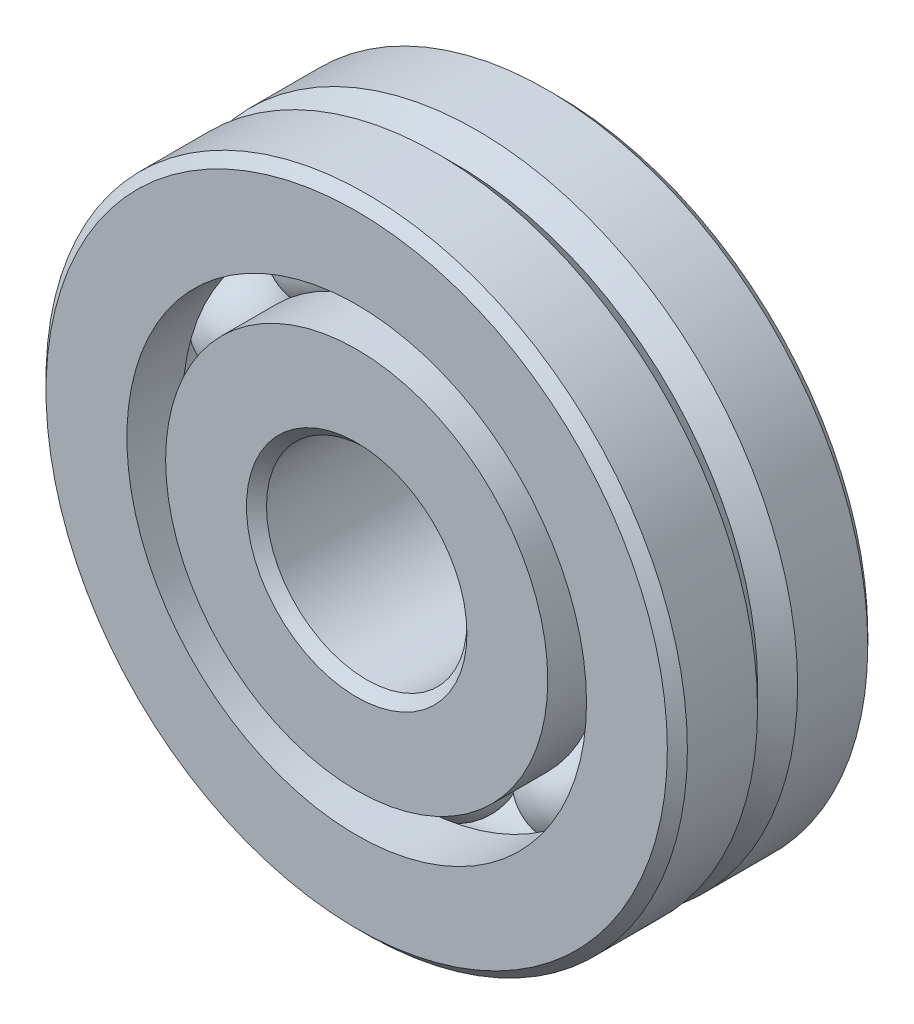
from build123d import *

# Parameters (mm, degrees)
CIRPATTERN1_COUNT = 10


with BuildPart() as part:
    # Sketch1 → Revolve1 (revolve)
    with BuildSketch(Plane(origin=(0, 0, 0), x_dir=(0, 0, -1), z_dir=(1, 0, 0))):
        with BuildLine():
            Line((2.25, 8), (0.5, 8))
            Line((0.5, 8), (0, 7.5))
            Line((0, 7.5), (-0.5, 8))
            Line((-0.5, 8), (-2.25, 8))
            Line((-2.25, 8), (-2.5, 7.75))
            Line((-2.5, 7.75), (-2.5, 5.733516484))
            Line((-2.5, 5.733516484), (-1.111111111, 5.733516484))
            ThreePointArc((-1.111111111, 5.733516484), (0, 6.461757439), (1.111111111, 5.733516484))
            Line((1.111111111, 5.733516484), (2.5, 5.733516484))
            Line((2.5, 5.733516484), (2.5, 7.75))
            Line((2.5, 7.75), (2.25, 8))
        make_face()
    revolve(axis=Axis((0, 0, 2.5), (0, 0, -1)))


with BuildPart() as body_2:
    # Sketch3 → Revolve3 (revolve)
    with BuildSketch(Plane(origin=(0, 0, 0), x_dir=(0, 0, -1), z_dir=(1, 0, 0))):
        with BuildLine():
            Line((-2.5, 4.766483516), (-1.111111111, 4.766483516))
            ThreePointArc((-1.111111111, 4.766483516), (0, 4.038242561), (1.111111111, 4.766483516))
            Line((1.111111111, 4.766483516), (2.5, 4.766483516))
            Line((2.5, 4.766483516), (2.5, 2.75))
            Line((2.5, 2.75), (2.25, 2.5))
            Line((2.25, 2.5), (-2.25, 2.5))
            Line((-2.25, 2.5), (-2.5, 2.75))
            Line((-2.5, 2.75), (-2.5, 4.766483516))
        make_face()
    revolve(axis=Axis((0, 0, 2.5), (0, 0, -1)))


with BuildPart() as body_3:
    # Sketch4 → Revolve4 (revolve)
    with BuildSketch(Plane(origin=(0, 0, 0), x_dir=(0, 0, -1), z_dir=(1, 0, 0))):
        with BuildLine():
            Line((-1.211757439, 5.25), (1.211757439, 5.25))
            ThreePointArc((1.211757439, 5.25), (0, 6.461757439), (-1.211757439, 5.25))
        make_face()
    revolve(axis=Axis((0, 5.25, 1.211757439), (0, 0, -1)))


with BuildPart() as cirpattern1_1:
    # CirPattern1: pattern copy
    add(body_3.part.rotate(Axis((0, 0, -2.5), (0, 0, 1)), 1 * 360 / CIRPATTERN1_COUNT))


with BuildPart() as cirpattern1_2:
    # CirPattern1: pattern copy
    add(body_3.part.rotate(Axis((0, 0, -2.5), (0, 0, 1)), 2 * 360 / CIRPATTERN1_COUNT))


with BuildPart() as cirpattern1_3:
    # CirPattern1: pattern copy
    add(body_3.part.rotate(Axis((0, 0, -2.5), (0, 0, 1)), 3 * 360 / CIRPATTERN1_COUNT))


with BuildPart() as cirpattern1_4:
    # CirPattern1: pattern copy
    add(body_3.part.rotate(Axis((0, 0, -2.5), (0, 0, 1)), 4 * 360 / CIRPATTERN1_COUNT))


with BuildPart() as cirpattern1_5:
    # CirPattern1: pattern copy
    add(body_3.part.rotate(Axis((0, 0, -2.5), (0, 0, 1)), 5 * 360 / CIRPATTERN1_COUNT))


with BuildPart() as cirpattern1_6:
    # CirPattern1: pattern copy
    add(body_3.part.rotate(Axis((0, 0, -2.5), (0, 0, 1)), 6 * 360 / CIRPATTERN1_COUNT))


with BuildPart() as cirpattern1_7:
    # CirPattern1: pattern copy
    add(body_3.part.rotate(Axis((0, 0, -2.5), (0, 0, 1)), 7 * 360 / CIRPATTERN1_COUNT))


with BuildPart() as cirpattern1_8:
    # CirPattern1: pattern copy
    add(body_3.part.rotate(Axis((0, 0, -2.5), (0, 0, 1)), 8 * 360 / CIRPATTERN1_COUNT))


with BuildPart() as cirpattern1_9:
    # CirPattern1: pattern copy
    add(body_3.part.rotate(Axis((0, 0, -2.5), (0, 0, 1)), 9 * 360 / CIRPATTERN1_COUNT))


solid = Compound([part.part, body_2.part, body_3.part, cirpattern1_1.part, cirpattern1_2.part, cirpattern1_3.part, cirpattern1_4.part, cirpattern1_5.part, cirpattern1_6.part, cirpattern1_7.part, cirpattern1_8.part, cirpattern1_9.part])
